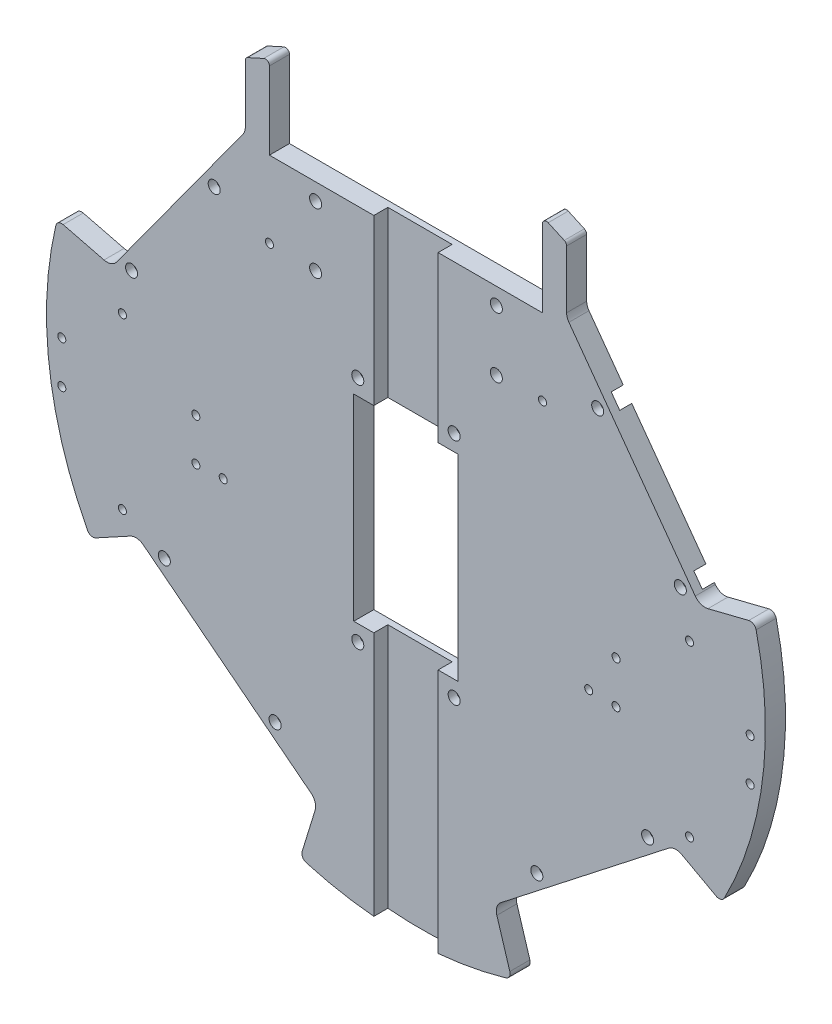
from build123d import *

# Parameters (mm, degrees)
EXTRUDE_2156_DEPTH      = 5
FILLET_3_R              = 1.5
FILLET_4_R              = 1.5
FILLET_5_R              = 1.5
FILLET_6_R              = 1.5
FILLET_8_R              = 1.5
FILLET_9_R              = 1.5
FILLET_10_R             = 1
SKETCH_5_R              = 1.5
CUT_EXTRUDE_4477_DEPTH  = 2
SKETCH_12_R             = 3.5
CUT_EXTRUDE_5428_DEPTH  = 3
CUT_EXTRUDE_START       = -3.5
CUT_EXTRUDE_6211_DEPTH  = 3.5
SKETCH_8_W              = 26
SKETCH_8_H              = 49
CUT_EXTRUDE_6713_DEPTH  = 5
SKETCH_9_R              = 1.5
CUT_EXTRUDE_7322_DEPTH  = 2
SKETCH_10_R             = 3.5
CUT_EXTRUDE_8110_DEPTH  = 3
SKETCH_11_R             = 1.5
CUT_EXTRUDE_8691_DEPTH  = 5
SKETCH_14_W             = 68
SKETCH_14_H             = 4
CUT_EXTRUDE_8943_DEPTH  = 10
SKETCH_15_R             = 1
CUT_EXTRUDE_9740_DEPTH  = 4
SKETCH_16_R             = 1
CUT_EXTRUDE_10725_DEPTH = 4
SKETCH_17_R             = 1
CUT_EXTRUDE_11590_DEPTH = 4
SKETCH_18_R             = 3.5
CUT_EXTRUDE_12205_DEPTH = 2
SKETCH_19_W             = 68
SKETCH_19_H             = 11
CUT_EXTRUDE_3_DEPTH     = 5


with BuildPart() as part:
    # 草图1 → Extrude 2156 (new body)
    with BuildSketch(Plane.XY):
        with BuildLine():
            Line((40.572949017, 63.247239682), (56.631189606, 41.14496766))
            Line((56.631189606, 41.14496766), (72.029031786, 19.951656069))
            ThreePointArc((72.029031786, 19.951656069), (73.431066875, 18.895554003), (75.184005217, 18.804663237))
            Line((75.184005217, 18.804663237), (86.825399574, 21.716353029))
            ThreePointArc((86.825399574, 21.716353029), (88.776371499, -11.358074817), (78.561436026, -42.875992928))
            Line((78.561436026, -42.875992928), (68.669508852, -37.477336526))
            ThreePointArc((68.669508852, -37.477336526), (66.987138464, -37.120716922), (65.385340306, -37.74664849))
            Line((65.385340306, -37.74664849), (43.096303273, -55.160752752))
            Line((43.096303273, -55.160752752), (23.649832714, -70.354000687))
            ThreePointArc((23.649832714, -70.354000687), (22.63495231, -71.818183128), (22.6292966, -73.599693854))
            Line((22.6292966, -73.599693854), (26.30288371, -85.547696103))
            ThreePointArc((26.30288371, -85.547696103), (0, -89.5), (-26.30288371, -85.547696103))
            Line((-26.30288371, -85.547696103), (-22.6292966, -73.599693854))
            ThreePointArc((-22.6292966, -73.599693854), (-22.63495231, -71.818183128), (-23.649832714, -70.354000687))
            Line((-23.649832714, -70.354000687), (-43.096303273, -55.160752752))
            Line((-43.096303273, -55.160752752), (-65.385340306, -37.74664849))
            ThreePointArc((-65.385340306, -37.74664849), (-66.987138464, -37.120716922), (-68.669508852, -37.477336526))
            Line((-68.669508852, -37.477336526), (-78.561436026, -42.875992928))
            ThreePointArc((-78.561436026, -42.875992928), (-88.776371499, -11.358074817), (-86.825399574, 21.716353029))
            Line((-86.825399574, 21.716353029), (-75.184005217, 18.804663237))
            ThreePointArc((-75.184005217, 18.804663237), (-73.431066875, 18.895554003), (-72.029031786, 19.951656069))
            Line((-72.029031786, 19.951656069), (-56.631189606, 41.14496766))
            Line((-56.631189606, 41.14496766), (-40.572949017, 63.247239682))
            ThreePointArc((-40.572949017, 63.247239682), (-40.146830451, 64.083544456), (-40, 65.010595439))
            Line((-40, 65.010595439), (-40, 74))
            Line((-40, 74), (-40, 80.06403687))
            Line((-40, 80.06403687), (-34, 82.790397994))
            Line((-34, 82.790397994), (-34, 77))
            Line((-34, 77), (34, 77))
            Line((34, 77), (34, 82.790397994))
            Line((34, 82.790397994), (40, 80.06403687))
            Line((40, 80.06403687), (40, 74))
            Line((40, 74), (40, 65.010595439))
            ThreePointArc((40, 65.010595439), (40.146830451, 64.083544456), (40.572949017, 63.247239682))
        make_face()
    extrude(amount=EXTRUDE_2156_DEPTH)

    # 圆角3
    fillet_3_edges = [part.edges().sort_by_distance(p)[0] for p in [
        (78.561436026, -42.875992928, 2.5),
    ]]
    fillet(fillet_3_edges, radius=FILLET_3_R)

    # 圆角4
    fillet_4_edges = [part.edges().sort_by_distance(p)[0] for p in [
        (26.30288371, -85.547696103, 2.5),
    ]]
    fillet(fillet_4_edges, radius=FILLET_4_R)

    # 圆角5
    fillet_5_edges = [part.edges().sort_by_distance(p)[0] for p in [
        (-26.30288371, -85.547696103, 2.5),
    ]]
    fillet(fillet_5_edges, radius=FILLET_5_R)

    # 圆角6
    fillet_6_edges = [part.edges().sort_by_distance(p)[0] for p in [
        (-78.561436026, -42.875992928, 2.5),
    ]]
    fillet(fillet_6_edges, radius=FILLET_6_R)

    # 圆角8
    fillet_8_edges = [part.edges().sort_by_distance(p)[0] for p in [
        (86.825399574, 21.716353029, 2.5),
    ]]
    fillet(fillet_8_edges, radius=FILLET_8_R)

    # 圆角9
    fillet_9_edges = [part.edges().sort_by_distance(p)[0] for p in [
        (-86.825399574, 21.716353029, 2.5),
    ]]
    fillet(fillet_9_edges, radius=FILLET_9_R)

    # 圆角10
    fillet_10_edges = [part.edges().sort_by_distance(p)[0] for p in [
        (-40, 80.06403687, 2.5),
        (-34, 82.790397994, 2.5),
        (34, 82.790397994, 2.5),
        (40, 80.06403687, 2.5),
    ]]
    fillet(fillet_10_edges, radius=FILLET_10_R)

    # 草图5 → Cut-Extrude 4477 (cut)
    with BuildSketch(Plane.XY.offset(5)):
        with Locations((47.738500848, 48.280798842)):
            Circle(SKETCH_5_R)
        with Locations((68.310984678, 19.965204039)):
            Circle(SKETCH_5_R)
        with Locations(Location((-68.310984678, 19.965204039, 0), (0, 0, 180))):
            Circle(SKETCH_5_R)
        with Locations(Location((-47.738500848, 48.280798842, 0), (0, 0, 180))):
            Circle(SKETCH_5_R)
        with Locations((60.161576933, -38.020845084)):
            Circle(SKETCH_5_R)
        with Locations((32.581200557, -59.56899672)):
            Circle(SKETCH_5_R)
        with Locations(Location((-60.161576933, -38.020845084, 0), (0, 0, 180))):
            Circle(SKETCH_5_R)
        with Locations(Location((-32.581200557, -59.56899672, 0), (0, 0, 180))):
            Circle(SKETCH_5_R)
    extrude(amount=-CUT_EXTRUDE_4477_DEPTH, mode=Mode.SUBTRACT)

    # 草图12 → Cut-Extrude 5428 (cut)
    with BuildSketch(Plane(origin=(0, 0, 0), x_dir=(-1, 0, 0), z_dir=(0, 0, -1))):
        with Locations((47.738500848, 48.280798842)):
            Circle(SKETCH_12_R)
        with Locations((68.310984678, 19.965204039)):
            Circle(SKETCH_12_R)
        with Locations((-68.310984678, 19.965204039)):
            Circle(SKETCH_12_R)
        with Locations((-47.738500848, 48.280798842)):
            Circle(SKETCH_12_R)
        with Locations((32.581200557, -59.56899672)):
            Circle(SKETCH_12_R)
        with Locations((60.161576933, -38.020845084)):
            Circle(SKETCH_12_R)
        with Locations((13.527038551, -115.928745256)):
            Circle(SKETCH_12_R)
        with Locations((-60.161576933, -38.020845084)):
            Circle(SKETCH_12_R)
        with Locations((-32.581200557, -59.56899672)):
            Circle(SKETCH_12_R)
    extrude(amount=-CUT_EXTRUDE_5428_DEPTH, mode=Mode.SUBTRACT)

    # 草图7 → Cut-Extrude 6211 (cut)
    with BuildSketch(Plane.XY.offset(5).offset(CUT_EXTRUDE_START)):
        with BuildLine():
            Line((-8, 77), (-8, -89.141741064))
            ThreePointArc((-8, -89.141741064), (0, -89.5), (8, -89.141741064))
            Line((8, -89.141741064), (8, 77))
            Line((8, 77), (-8, 77))
        make_face()
    extrude(amount=CUT_EXTRUDE_6211_DEPTH, mode=Mode.SUBTRACT)

    # 草图8 → Cut-Extrude 6713 (cut)
    with BuildSketch(Plane.XY.offset(5)):
        with Locations((0, -3.5)):
            Rectangle(SKETCH_8_W, SKETCH_8_H)
    extrude(amount=-CUT_EXTRUDE_6713_DEPTH, mode=Mode.SUBTRACT)

    # 草图9 → Cut-Extrude 7322 (cut)
    with BuildSketch(Plane.XY.offset(5)):
        with Locations((12, 25)):
            Circle(SKETCH_9_R)
        with Locations(Location((-12, 25, 0), (0, 0, 180))):
            Circle(SKETCH_9_R)
        with Locations((-12, -32)):
            Circle(SKETCH_9_R)
        with Locations(Location((12, -32, 0), (0, 0, 180))):
            Circle(SKETCH_9_R)
    extrude(amount=-CUT_EXTRUDE_7322_DEPTH, mode=Mode.SUBTRACT)

    # 草图10 → Cut-Extrude 8110 (cut)
    with BuildSketch(Plane(origin=(0, 0, 0), x_dir=(-1, 0, 0), z_dir=(0, 0, -1))):
        with Locations((12, 25)):
            Circle(SKETCH_10_R)
        with Locations(Location((-12, 25, 0), (0, 0, 180))):
            Circle(SKETCH_10_R)
        with Locations(Location((12, -32, 0), (0, 0, 180))):
            Circle(SKETCH_10_R)
        with Locations((-12, -32)):
            Circle(SKETCH_10_R)
    extrude(amount=-CUT_EXTRUDE_8110_DEPTH, mode=Mode.SUBTRACT)

    # 草图11 → Cut-Extrude 8691 (cut)
    with BuildSketch(Plane.XY.offset(5)):
        with Locations((22.5, 57.8)):
            Circle(SKETCH_11_R)
        with Locations((22.5, 42.8)):
            Circle(SKETCH_11_R)
        with Locations(Location((-22.5, 42.8, 0), (0, 0, 180))):
            Circle(SKETCH_11_R)
        with Locations(Location((-22.5, 57.8, 0), (0, 0, 180))):
            Circle(SKETCH_11_R)
    extrude(amount=-CUT_EXTRUDE_8691_DEPTH, mode=Mode.SUBTRACT)

    # 草图14 → Cut-Extrude 8943 (cut)
    with BuildSketch(Plane(origin=(0, 0, 0), x_dir=(-1, 0, 0), z_dir=(0, 0, -1))):
        with Locations((0, 75)):
            Rectangle(SKETCH_14_W, SKETCH_14_H)
    extrude(amount=-CUT_EXTRUDE_8943_DEPTH, mode=Mode.SUBTRACT)

    # 草图15 → Cut-Extrude 9740 (cut)
    with BuildSketch(Plane.XY.offset(5)):
        with Locations(Location((-45.5, -13.5, 0), (0, 0, 180))):
            Circle(SKETCH_15_R)
        with Locations(Location((-34, 43, 0), (0, 0, 180))):
            Circle(SKETCH_15_R)
        with Locations((34, 43)):
            Circle(SKETCH_15_R)
        with Locations((45.5, -13.5)):
            Circle(SKETCH_15_R)
    extrude(amount=-CUT_EXTRUDE_9740_DEPTH, mode=Mode.SUBTRACT)

    # 草图16 → Cut-Extrude 10725 (cut)
    with BuildSketch(Plane.XY.offset(5)):
        with Locations((-70.6, -32.7)):
            Circle(SKETCH_16_R)
        with Locations((-70.6, 9.5)):
            Circle(SKETCH_16_R)
        with Locations((70.6, 9.5)):
            Circle(SKETCH_16_R)
        with Locations((70.6, -32.7)):
            Circle(SKETCH_16_R)
    extrude(amount=-CUT_EXTRUDE_10725_DEPTH, mode=Mode.SUBTRACT)

    # 草图17 → Cut-Extrude 11590 (cut)
    with BuildSketch(Plane.XY.offset(5)):
        with Locations((85.690046638, -3.237648509)):
            Circle(SKETCH_17_R)
        with Locations((85.690046638, -13.762351491)):
            Circle(SKETCH_17_R)
        with Locations((52.309953362, -13.762351491)):
            Circle(SKETCH_17_R)
        with Locations((52.309953362, -3.237648509)):
            Circle(SKETCH_17_R)
        with Locations(Location((-52.309953362, -13.762351491, 0), (0, 0, 180))):
            Circle(SKETCH_17_R)
        with Locations(Location((-85.690046638, -3.237648509, 0), (0, 0, 180))):
            Circle(SKETCH_17_R)
        with Locations(Location((-52.309953362, -3.237648509, 0), (0, 0, 180))):
            Circle(SKETCH_17_R)
        with Locations(Location((-85.690046638, -13.762351491, 0), (0, 0, 180))):
            Circle(SKETCH_17_R)
    extrude(amount=-CUT_EXTRUDE_11590_DEPTH, mode=Mode.SUBTRACT)

    # 草图18 → Cut-Extrude 12205 (cut)
    with BuildSketch(Plane(origin=(0, 0, 0), x_dir=(-1, 0, 0), z_dir=(0, 0, -1))):
        with Locations((-22.5, 57.8)):
            Circle(SKETCH_18_R)
        with Locations((-22.5, 42.8)):
            Circle(SKETCH_18_R)
        with Locations((22.5, 42.8)):
            Circle(SKETCH_18_R)
        with Locations((22.5, 57.8)):
            Circle(SKETCH_18_R)
    extrude(amount=-CUT_EXTRUDE_12205_DEPTH, mode=Mode.SUBTRACT)

    # 草图19 → 切除-拉伸3 (cut, symmetric)
    with BuildSketch(Plane.XY.offset(5)):
        with Locations((0, 67.5)):
            Rectangle(SKETCH_19_W, SKETCH_19_H)
    extrude(amount=CUT_EXTRUDE_3_DEPTH, both=True, mode=Mode.SUBTRACT)


solid = part.part
